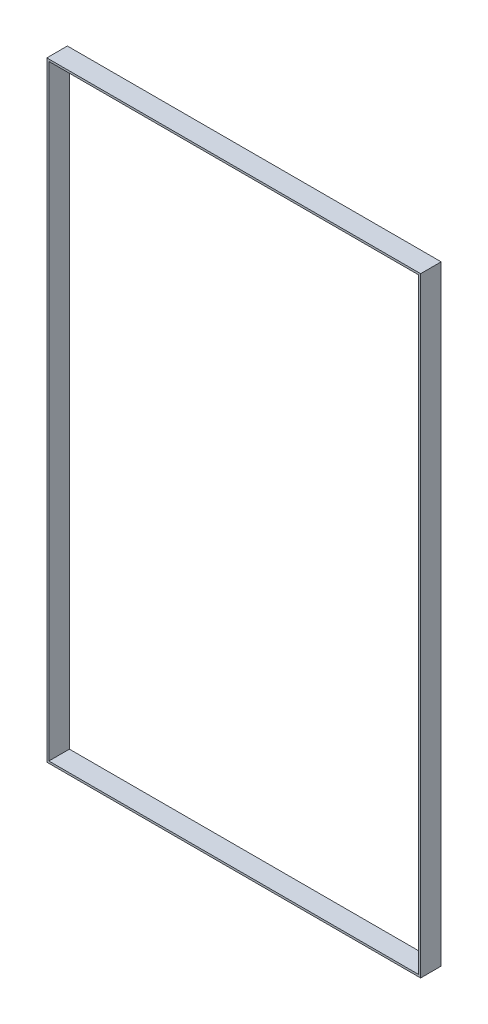
from build123d import *

# Parameters (mm, degrees)
ESBO_O1_W                = 182
ESBO_O1_H                = 297
ESBO_O1_W_2              = 180
ESBO_O1_H_2              = 295
RESSALTO_EXTRUS_O1_DEPTH = 10


with BuildPart() as part:
    # Esboço1 → Ressalto-extrusão1 (new body)
    with BuildSketch(Plane.XY):
        Rectangle(ESBO_O1_W, ESBO_O1_H)
        Rectangle(ESBO_O1_W_2, ESBO_O1_H_2, mode=Mode.SUBTRACT)
    extrude(amount=RESSALTO_EXTRUS_O1_DEPTH)


solid = part.part
